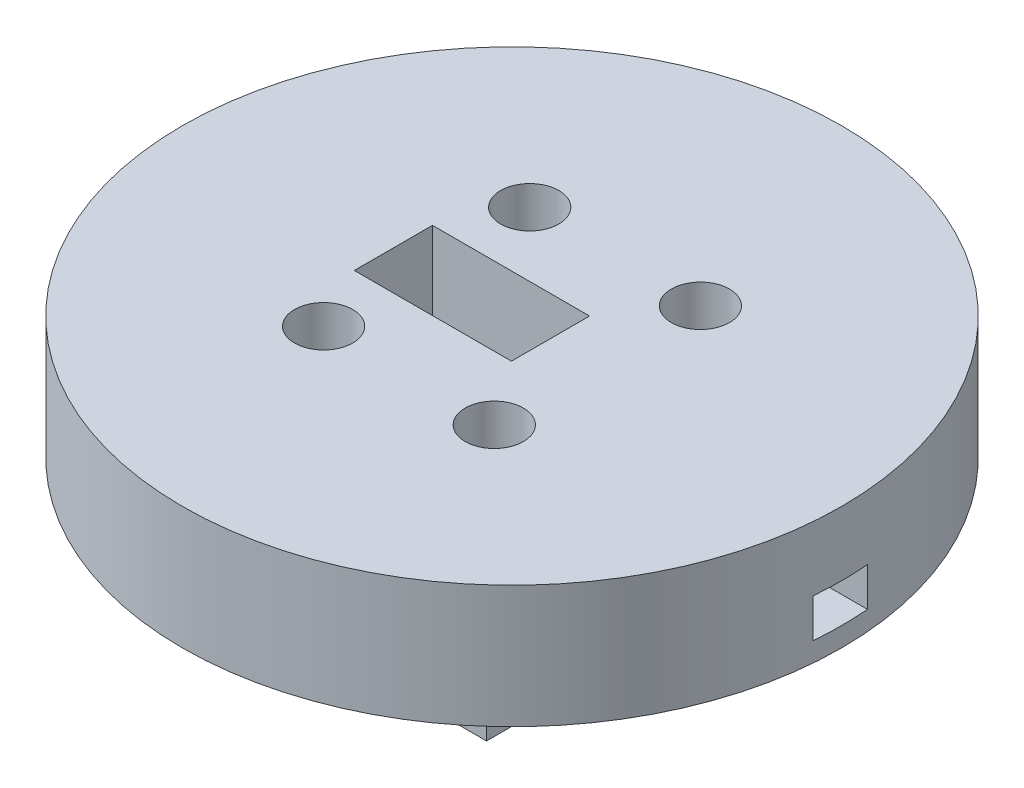
from build123d import *

# Parameters (mm, degrees)
SKETCH1_W           = 60
SKETCH1_H           = 30
BOSS_EXTRUDE1_DEPTH = 36.57
CUT_EXTRUDE1_DEPTH  = 60
CUT_EXTRUDE2_REACH  = 82.464
CUT_EXTRUDE3_DEPTH  = 73.14
SKETCH5_R           = 3.75
CUT_EXTRUDE4_DEPTH  = 30
SKETCH6_R           = 7.5
CUT_EXTRUDE5_DEPTH  = 20
SKETCH8_R           = 85
BOSS_EXTRUDE3_DEPTH = 31.6
CUT_EXTRUDE6_START  = -31.6
SKETCH9_R           = 7.5
CUT_EXTRUDE6_DEPTH  = 31.6
SKETCH11_W          = 40.5
SKETCH11_H          = 20.15
CUT_EXTRUDE7_DEPTH  = 26.6
BOSS_EXTRUDE4_DEPTH = 73.14
SKETCH13_R          = 7.5
CUT_EXTRUDE8_DEPTH  = 51.6
FILLET1_R           = 8
SKETCH14_W          = 14
SKETCH14_H          = 10
CUT_EXTRUDE9_DEPTH  = 84


with BuildPart() as part:
    # Sketch1 → Boss-Extrude1 (new, symmetric)
    with BuildSketch(Plane.XY):
        Rectangle(SKETCH1_W, SKETCH1_H)
    extrude(amount=BOSS_EXTRUDE1_DEPTH, both=True)

    # Sketch2 → Cut-Extrude1 (cut)
    with BuildSketch(Plane(origin=(30, 0, 0), x_dir=(0, 0, -1), z_dir=(1, 0, 0))):
        with BuildLine():
            ThreePointArc((6, -15), (0, -9), (-6, -15))
            Line((-6, -15), (6, -15))
        make_face()
    extrude(amount=-CUT_EXTRUDE1_DEPTH, mode=Mode.SUBTRACT)

    # Cut-Extrude2: up to this face of the body (flat: up to its plane)
    cut_extrude2_end = Plane(part.part.faces().sort_by_distance((0, 0, -36.57))[0])
    # Sketch3 → Cut-Extrude2 (cut, up to the picked face)
    with BuildSketch(Plane.XY.offset(36.57), mode=Mode.PRIVATE) as cut_extrude2_sk1:
        with BuildLine():
            Line((6.075, 0), (11.075, 0))
            Line((11.075, 0), (15.094237886, -15))
            Line((15.094237886, -15), (-15.094237886, -15))
            Line((-15.094237886, -15), (-11.075, 0))
            Line((-11.075, 0), (-6.075, 0))
            ThreePointArc((-6.075, 0), (0, 6.075), (6.075, 0))
        make_face()
    cut_extrude2_tool1 = split(extrude(cut_extrude2_sk1.sketch, amount=-CUT_EXTRUDE2_REACH, mode=Mode.PRIVATE), bisect_by=cut_extrude2_end, keep=Keep.BOTH, mode=Mode.PRIVATE)
    add(cut_extrude2_tool1.solids().sort_by(Axis((0, -6.537689, 36.57), (0, 0, -1)))[0], mode=Mode.SUBTRACT)

    # Sketch4 → Cut-Extrude3 (cut)
    with BuildSketch(Plane.XY.offset(36.57)):
        Polygon((30, 15), (30, -5), (10, 15), align=None)
        Polygon((-30, 15), (-30, -5), (-10, 15), align=None)
    extrude(amount=-CUT_EXTRUDE3_DEPTH, mode=Mode.SUBTRACT)

    # Sketch5 → Cut-Extrude4 (cut)
    with BuildSketch(Plane(origin=(0, 15, 0), x_dir=(1, 0, 0), z_dir=(0, 1, 0))):
        with Locations(Location((22, -26.57, 0), (0, 0, 180))):
            Circle(SKETCH5_R)
        with Locations(Location((-22, -26.57, 0), (0, 0, 180))):
            Circle(SKETCH5_R)
        with Locations(Location((22, 26.57, 0), (0, 0, 180))):
            Circle(SKETCH5_R)
        with Locations(Location((-22, 26.57, 0), (0, 0, 180))):
            Circle(SKETCH5_R)
    extrude(amount=-CUT_EXTRUDE4_DEPTH, mode=Mode.SUBTRACT)

    # Sketch6 → Cut-Extrude5 (cut)
    with BuildSketch(Plane(origin=(0, 15, 0), x_dir=(1, 0, 0), z_dir=(0, 1, 0))):
        with Locations(Location((22, -26.57, 0), (0, 0, 180))):
            Circle(SKETCH6_R)
        with Locations((-22, -26.57)):
            Circle(SKETCH6_R)
        with Locations(Location((22, 26.57, 0), (0, 0, 180))):
            Circle(SKETCH6_R)
        with Locations(Location((-22, 26.57, 0), (0, 0, 180))):
            Circle(SKETCH6_R)
    extrude(amount=-CUT_EXTRUDE5_DEPTH, mode=Mode.SUBTRACT)

    # Sketch8 → Boss-Extrude3 (add)
    with BuildSketch(Plane(origin=(0, 15, 0), x_dir=(1, 0, 0), z_dir=(0, 1, 0))):
        with Locations(Location((0, 0, 0), (0, 0, 180))):
            Circle(SKETCH8_R)
    extrude(amount=BOSS_EXTRUDE3_DEPTH)

    # Sketch9 → Cut-Extrude6 (cut)
    with BuildSketch(Plane.XZ.offset(-15).offset(CUT_EXTRUDE6_START)):
        with Locations(Location((22, 26.57, 0), (0, 0, 180))):
            Circle(SKETCH9_R)
        with Locations(Location((22, -26.57, 0), (0, 0, 180))):
            Circle(SKETCH9_R)
        with Locations(Location((-22, -26.57, 0), (0, 0, 180))):
            Circle(SKETCH9_R)
        with Locations((-22, 26.57)):
            Circle(SKETCH9_R)
    extrude(amount=CUT_EXTRUDE6_DEPTH, mode=Mode.SUBTRACT)

    # Sketch11 → Cut-Extrude7 (cut)
    with BuildSketch(Plane(origin=(0, 46.6, 0), x_dir=(1, 0, 0), z_dir=(0, 1, 0))):
        with Locations((-10.25, -0.075)):
            Rectangle(SKETCH11_W, SKETCH11_H)
    extrude(amount=-CUT_EXTRUDE7_DEPTH, mode=Mode.SUBTRACT)

    # Sketch12 → Boss-Extrude4 (add)
    with BuildSketch(Plane.XY.offset(36.57)):
        Polygon((30, -5), (30, 15), (10, 15), align=None)
        Polygon((-10, 15), (-30, -5), (-30, 15), align=None)
    extrude(amount=-BOSS_EXTRUDE4_DEPTH)

    # Sketch13 → Cut-Extrude8 (cut)
    with BuildSketch(Plane(origin=(0, 46.6, 0), x_dir=(1, 0, 0), z_dir=(0, 1, 0))):
        with Locations(Location((22, 26.57, 0), (0, 0, 180))):
            Circle(SKETCH13_R)
        with Locations(Location((-22, 26.57, 0), (0, 0, 180))):
            Circle(SKETCH13_R)
        with Locations(Location((-22, -26.57, 0), (0, 0, 180))):
            Circle(SKETCH13_R)
        with Locations(Location((22, -26.57, 0), (0, 0, 180))):
            Circle(SKETCH13_R)
    extrude(amount=-CUT_EXTRUDE8_DEPTH, mode=Mode.SUBTRACT)

    # Fillet1
    fillet1_edges = [part.edges().sort_by_distance(p)[0] for p in [
        (30, 15, 0),
        (-30, 15, 0),
        (0, 15, -36.57),
        (0, 15, 36.57),
    ]]
    fillet(fillet1_edges, radius=FILLET1_R)

    # Sketch14 → Cut-Extrude9 (cut)
    with BuildSketch(Plane.ZY.offset(-10)):
        with Locations((0.075, 25)):
            Rectangle(SKETCH14_W, SKETCH14_H)
    extrude(amount=-CUT_EXTRUDE9_DEPTH, mode=Mode.SUBTRACT)


solid = part.part
